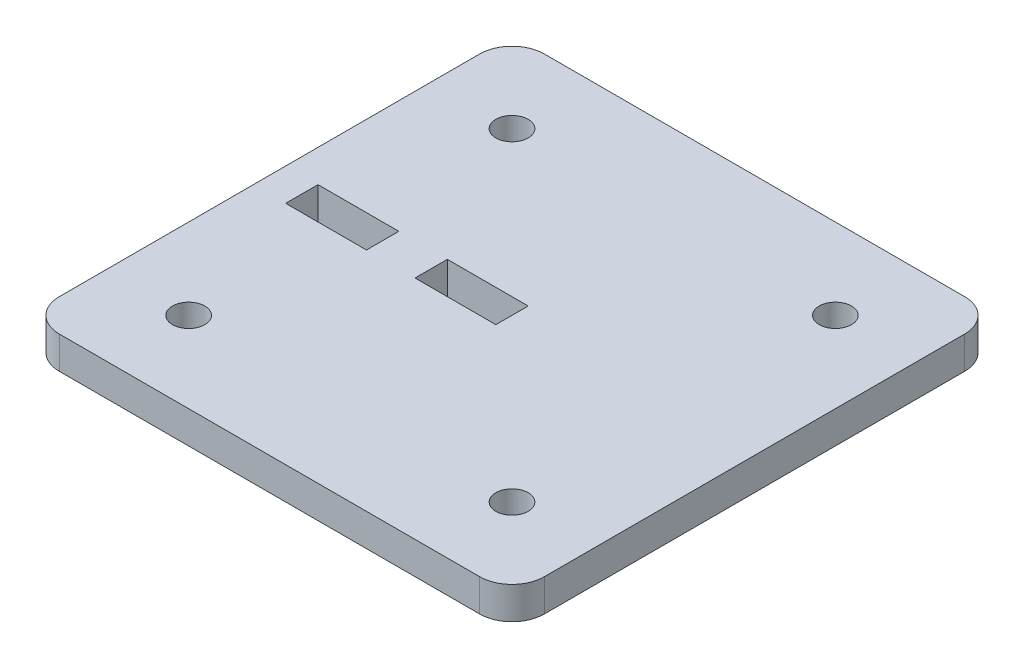
from build123d import *

# Parameters (mm, degrees)
SKETCH1_W           = 30
SKETCH1_H           = 30
BOSS_EXTRUDE1_DEPTH = 2
SKETCH2_R           = 1
SKETCH2_W           = 5
SKETCH2_H           = 2
CUT_EXTRUDE1_DEPTH  = 2
FILLET2_R           = 2


with BuildPart() as part:
    # Sketch1 → Boss-Extrude1 (new body)
    with BuildSketch(Plane(origin=(0, 0, 0), x_dir=(1, 0, 0), z_dir=(0, 1, 0))):
        Rectangle(SKETCH1_W, SKETCH1_H)
    extrude(amount=BOSS_EXTRUDE1_DEPTH)

    # Sketch2 → Cut-Extrude1 (cut)
    with BuildSketch(Plane(origin=(0, 2, 0), x_dir=(1, 0, 0), z_dir=(0, 1, 0))):
        with Locations(Location((10, 10, 0), (0, 0, 270))):
            Circle(SKETCH2_R)
        with Locations(Location((10, -10, 0), (0, 0, 90))):
            Circle(SKETCH2_R)
        with Locations(Location((-10, -10, 0), (0, 0, 270))):
            Circle(SKETCH2_R)
        with Locations(Location((-10, 10, 0), (0, 0, 90))):
            Circle(SKETCH2_R)
        with Locations((-2.5, 0)):
            Rectangle(SKETCH2_W, SKETCH2_H)
        with Locations((-10.5, 0)):
            Rectangle(SKETCH2_W, SKETCH2_H)
    extrude(amount=-CUT_EXTRUDE1_DEPTH, mode=Mode.SUBTRACT)

    # Fillet2
    fillet2_edges = [part.edges().sort_by_distance(p)[0] for p in [
        (-15, 1, -15),
        (15, 1, -15),
        (15, 1, 15),
        (-15, 1, 15),
    ]]
    fillet(fillet2_edges, radius=FILLET2_R)


solid = part.part
